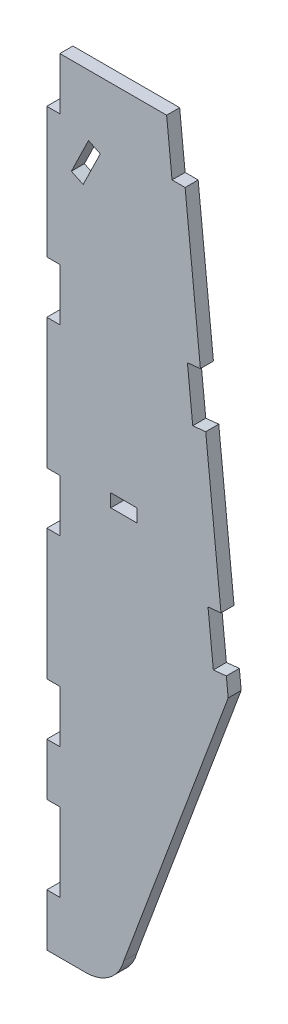
from build123d import *

# Parameters (mm, degrees)
ESQUISSE1_W             = 10
ESQUISSE1_H             = 5
BOSS_EXTRU_1_DEPTH      = 5
ENL_V_MAT_EXTRU_1_DEPTH = 307.896155075


with BuildPart() as part:
    # Esquisse1 → Boss.-Extru.1 (new body)
    with BuildSketch(Plane.XY):
        with BuildLine():
            Line((0, 0), (43, 0))
            Line((43, 0), (43, -20.443064708))
            Line((43, -20.443064708), (48, -20.443064708))
            Line((48, -20.443064708), (53.856481481, -77.64404044))
            Line((53.856481481, -77.64404044), (48.882483592, -78.153299699))
            Line((48.882483592, -78.153299699), (50.919520629, -98.049291258))
            Line((50.919520629, -98.049291258), (55.893518519, -97.540031998))
            Line((55.893518519, -97.540031998), (61.75, -154.74100773))
            Line((61.75, -154.74100773), (56.77600211, -155.250266989))
            Line((56.77600211, -155.250266989), (58.813039147, -175.146258548))
            Line((58.813039147, -175.146258548), (63.787037037, -174.636999289))
            Line((63.787037037, -174.636999289), (64.5, -181.600596335))
            Line((64.5, -181.600596335), (24.488887394, -288.882285677))
            ThreePointArc((24.488887394, -288.882285677), (19.131421435, -296.900300104), (10, -300))
            Line((10, -300), (-5, -300))
            Line((-5, -300), (-5, -280))
            Line((-5, -280), (0, -280))
            Line((0, -280), (0, -250))
            Line((0, -250), (-5, -250))
            Line((-5, -250), (-5, -230))
            Line((-5, -230), (0, -230))
            Line((0, -230), (0, -210))
            Line((0, -210), (-5, -210))
            Line((-5, -210), (-5, -160))
            Line((-5, -160), (0, -160))
            Line((0, -160), (0, -140))
            Line((0, -140), (-5, -140))
            Line((-5, -140), (-5, -90))
            Line((-5, -90), (0, -90))
            Line((0, -90), (0, -70))
            Line((0, -70), (-5, -70))
            Line((-5, -70), (-5, -20))
            Line((-5, -20), (0, -20))
            Line((0, -20), (0, 0))
        make_face()
        with Locations((24.5, -138.5)):
            Rectangle(ESQUISSE1_W, ESQUISSE1_H, mode=Mode.SUBTRACT)
        Polygon((11.000546858, -23.352307985), (4.424979656, -36.83421868), (8.918949887, -39.026074414), (15.494517089, -25.544163719), align=None, mode=Mode.SUBTRACT)
    extrude(amount=BOSS_EXTRU_1_DEPTH)

    # Esquisse3 → Enlèv. mat.-Extru.1 (cut, through all)
    with BuildSketch(Plane(origin=(0, 0, 0), x_dir=(-1, 0, 0), z_dir=(0, 0, -1))):
        Polygon((-43, -20.443064708), (-40.91621031, 0), (-43, 0), align=None)
    extrude(amount=-ENL_V_MAT_EXTRU_1_DEPTH, mode=Mode.SUBTRACT)


solid = part.part
